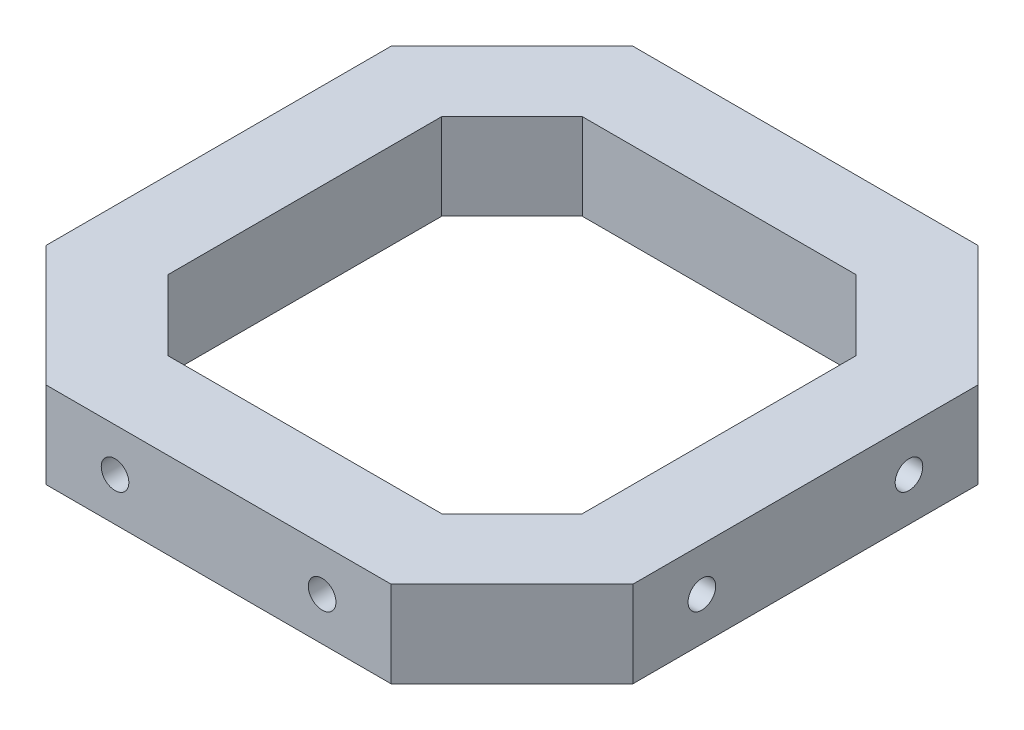
from build123d import *

# Parameters (mm, degrees)
EXTRUDE_1_DEPTH     = 5
SKETCH_2_R          = 0.8
CUT_EXTRUDE_1_DEPTH = 3
CUT_EXTRUDE_START   = -31
SKETCH_2_3_R        = 0.8
CUT_EXTRUDE_2_DEPTH = 3
SKETCH_3_R          = 0.8
CUT_EXTRUDE_3_DEPTH = 3
SKETCH_3_2_R        = 0.8
CUT_EXTRUDE_4_DEPTH = 3


with BuildPart() as part:
    # 草图1 → 凸台-拉伸1 (new body)
    with BuildSketch(Plane(origin=(0, 0, 0), x_dir=(1, 0, 0), z_dir=(0, 1, 0))):
        Polygon((-17, 10), (-17, -10), (-10, -17), (10, -17), (17, -10), (17, 10), (10, 17), (-10, 17), align=None)
        Polygon((-7.928932188, 12), (-12, 7.928932188), (-12, -7.928932188), (-7.928932188, -12), (7.928932188, -12), (12, -7.928932188), (12, 7.928932188), (7.928932188, 12), align=None, mode=Mode.SUBTRACT)
    extrude(amount=EXTRUDE_1_DEPTH)

    # 草图2 → 切除-拉伸1 (cut)
    with BuildSketch(Plane(origin=(0, 0, -17), x_dir=(-1, 0, 0), z_dir=(0, 0, -1))):
        with Locations((6, 2.5)):
            Circle(SKETCH_2_R)
        with Locations((-6, 2.5)):
            Circle(SKETCH_2_R)
    extrude(amount=-CUT_EXTRUDE_1_DEPTH, mode=Mode.SUBTRACT)

    # 草图2<3> → 切除-拉伸2 (cut)
    with BuildSketch(Plane(origin=(0, 0, -17), x_dir=(-1, 0, 0), z_dir=(0, 0, -1)).offset(CUT_EXTRUDE_START)):
        with Locations((6, 2.5)):
            Circle(SKETCH_2_3_R)
        with Locations((-6, 2.5)):
            Circle(SKETCH_2_3_R)
    extrude(amount=-CUT_EXTRUDE_2_DEPTH, mode=Mode.SUBTRACT)

    # 草图3 → 切除-拉伸3 (cut)
    with BuildSketch(Plane.ZY.offset(17)):
        with Locations((-6, 2.5)):
            Circle(SKETCH_3_R)
        with Locations((6, 2.5)):
            Circle(SKETCH_3_R)
    extrude(amount=-CUT_EXTRUDE_3_DEPTH, mode=Mode.SUBTRACT)

    # 草图3<2> → 切除-拉伸4 (cut)
    with BuildSketch(Plane.ZY.offset(17).offset(CUT_EXTRUDE_START)):
        with Locations((-6, 2.5)):
            Circle(SKETCH_3_2_R)
        with Locations((6, 2.5)):
            Circle(SKETCH_3_2_R)
    extrude(amount=-CUT_EXTRUDE_4_DEPTH, mode=Mode.SUBTRACT)


solid = part.part
